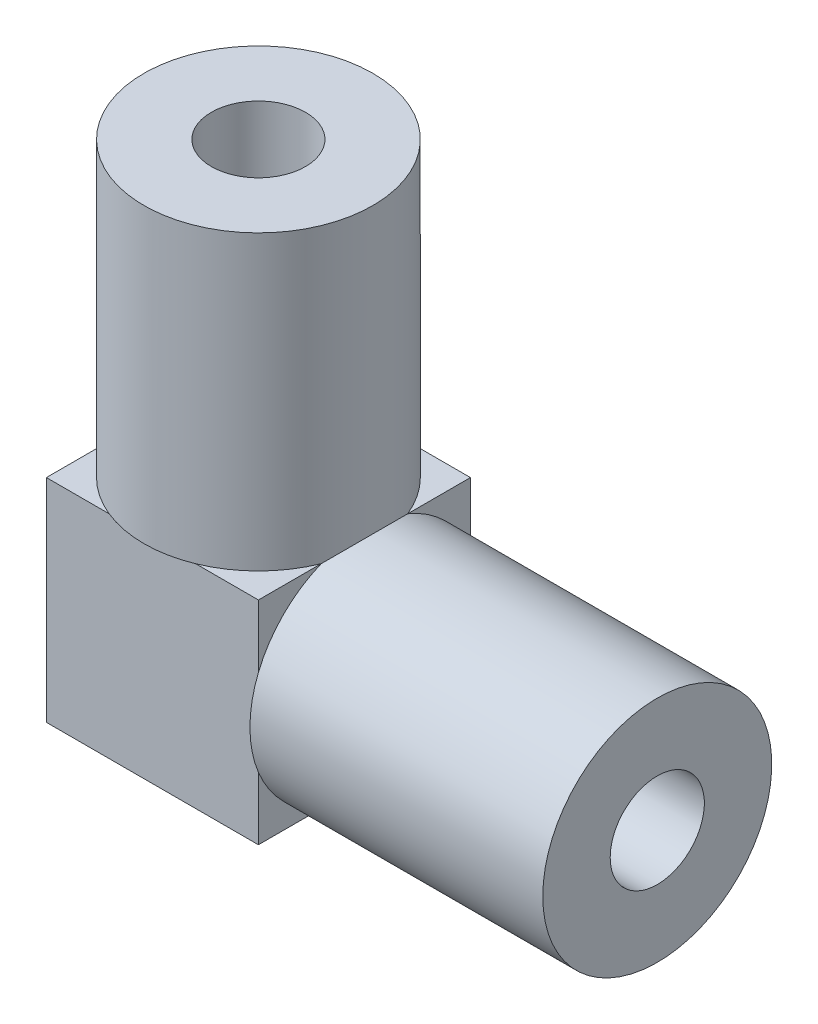
from build123d import *

# Parameters (mm, degrees)
BLOCK_SKETCH_W    = 14.3
BLOCK_SKETCH_H    = 14.3
BLOCK_DEPTH       = 7.15
ARM_X_SKETCH_W    = 19.75
ARM_X_SKETCH_H    = 7.722
ARM_Y_SKETCH_W    = 7.722
ARM_Y_SKETCH_H    = 19.75
SOCKET_X_SKETCH_W = 16.2
SOCKET_X_SKETCH_H = 3.175
SOCKET_Y_SKETCH_W = 3.175
SOCKET_Y_SKETCH_H = 16.2


with BuildPart() as part:
    # Block Sketch → Block (new, symmetric)
    with BuildSketch(Plane.XY):
        Rectangle(BLOCK_SKETCH_W, BLOCK_SKETCH_H)
    extrude(amount=BLOCK_DEPTH, both=True)

    # Arm X Sketch → Arm X (revolve)
    with BuildSketch(Plane.XY):
        with Locations((17.025, 3.861)):
            Rectangle(ARM_X_SKETCH_W, ARM_X_SKETCH_H)
    revolve(axis=Axis((-1000, 0, 0), (1, 0, 0)))

    # Arm Y Sketch → Arm Y (revolve)
    with BuildSketch(Plane.XY):
        with Locations((3.861, 17.025)):
            Rectangle(ARM_Y_SKETCH_W, ARM_Y_SKETCH_H)
    revolve(axis=Axis((0, -500, 0), (0, 1, 0)))

    # Socket X Sketch → Socket X (revolve, cut)
    with BuildSketch(Plane.XY):
        with Locations((19.8, 1.5875)):
            Rectangle(SOCKET_X_SKETCH_W, SOCKET_X_SKETCH_H)
    revolve(axis=Axis((-1000, 0, 0), (1, 0, 0)), mode=Mode.SUBTRACT)

    # Socket Y Sketch → Socket Y (revolve, cut)
    with BuildSketch(Plane.XY):
        with Locations((1.5875, 19.8)):
            Rectangle(SOCKET_Y_SKETCH_W, SOCKET_Y_SKETCH_H)
    revolve(axis=Axis((0, -500, 0), (0, 1, 0)), mode=Mode.SUBTRACT)


solid = part.part
